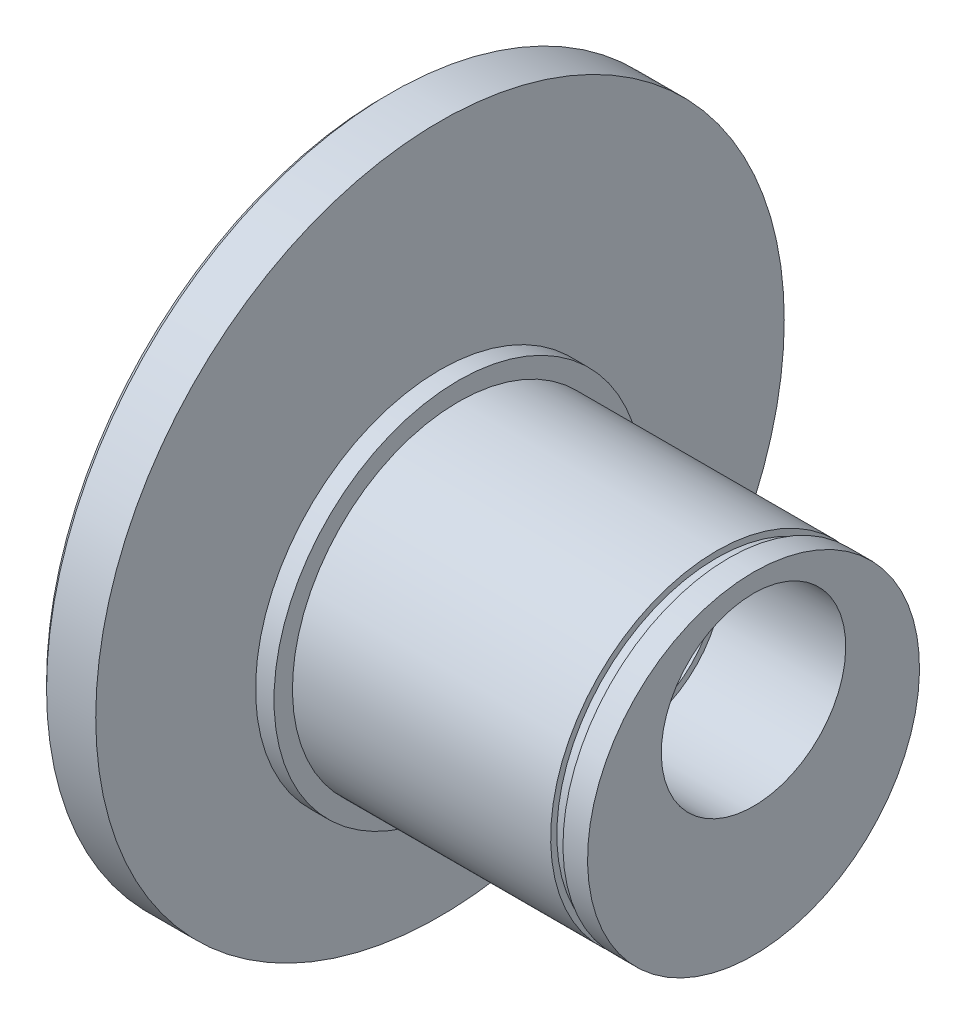
from build123d import *

# Parameters (mm, degrees)
ESQUISSE2_R             = 24.5
ENL_V_MAT_EXTRU_1_DEPTH = 10
ESQUISSE4_R             = 14
ENL_V_MAT_EXTRU_2_DEPTH = 97.42095208
ESQUISSE5_R             = 15
ENL_V_MAT_EXTRU_3_DEPTH = 20
ENL_V_START             = -20
ESQUISSE6_R             = 15
ENL_V_MAT_EXTRU_4_DEPTH = 20


with BuildPart() as part:
    # Esquisse1 → Révolution1 (revolve)
    with BuildSketch(Plane.XY, mode=Mode.PRIVATE) as r_volution1_sk:
        Polygon((0, 0), (0, 35), (5, 35), (5, 55), (6, 56), (14, 56), (14, 0), align=None)
    revolve(r_volution1_sk.sketch.rotate(Axis((0, 0, 0), (1, 0, 0)), 90), axis=Axis((0, 0, 0), (1, 0, 0)))

    # Esquisse2 → Enlèv. mat.-Extru.1 (cut)
    with BuildSketch(Plane.ZY):
        Circle(ESQUISSE2_R)
    extrude(amount=-ENL_V_MAT_EXTRU_1_DEPTH, mode=Mode.SUBTRACT)

    # Esquisse3 → Révolution2 (revolve)
    with BuildSketch(Plane.XY):
        Polygon((14, 21), (17, 21), (17, 18), (59, 18), (59, 17), (61, 17), (61, 18), (65, 18), (65, -9), (14, -9), align=None)
    revolve(axis=Axis((58.599942934, -9, 0), (-1, 0, 0)))

    # Esquisse4 → Enlèv. mat.-Extru.2 (cut, through all)
    with BuildSketch(Plane.ZY.offset(-10)):
        Circle(ESQUISSE4_R)
    extrude(amount=-ENL_V_MAT_EXTRU_2_DEPTH, mode=Mode.SUBTRACT)

    # Esquisse5 → Enlèv. mat.-Extru.3 (cut)
    with BuildSketch(Plane.ZY.offset(-10)):
        Circle(ESQUISSE5_R)
    extrude(amount=-ENL_V_MAT_EXTRU_3_DEPTH, mode=Mode.SUBTRACT)

    # Esquisse6 → Enlèv. mat.-Extru.4 (cut)
    with BuildSketch(Plane(origin=(65, 0, 0), x_dir=(0, 0, -1), z_dir=(1, 0, 0)).offset(ENL_V_START)):
        with Locations(Location((0, 0, 0), (0, 0, 180))):
            Circle(ESQUISSE6_R)
    extrude(amount=ENL_V_MAT_EXTRU_4_DEPTH, mode=Mode.SUBTRACT)


solid = part.part
